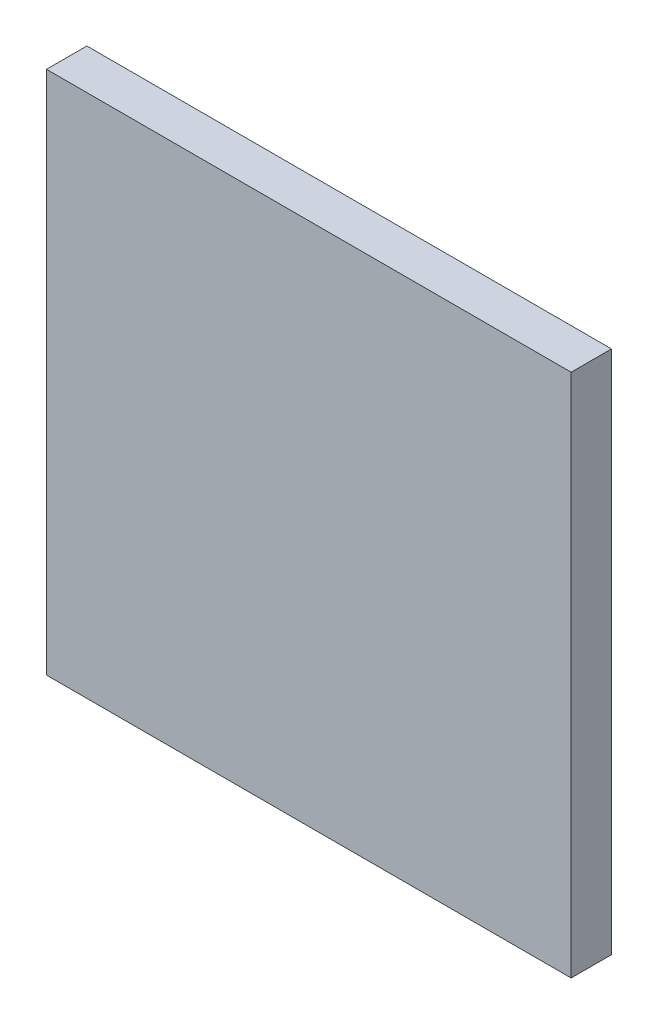
from build123d import *

# Parameters (mm, degrees)
SKETCH_1_W      = 65
SKETCH_1_H      = 65
EXTRUDE_1_DEPTH = 5


with BuildPart() as part:
    # 草图1 → 凸台-拉伸1 (new body)
    with BuildSketch(Plane.XY):
        Rectangle(SKETCH_1_W, SKETCH_1_H)
    extrude(amount=EXTRUDE_1_DEPTH)


solid = part.part
